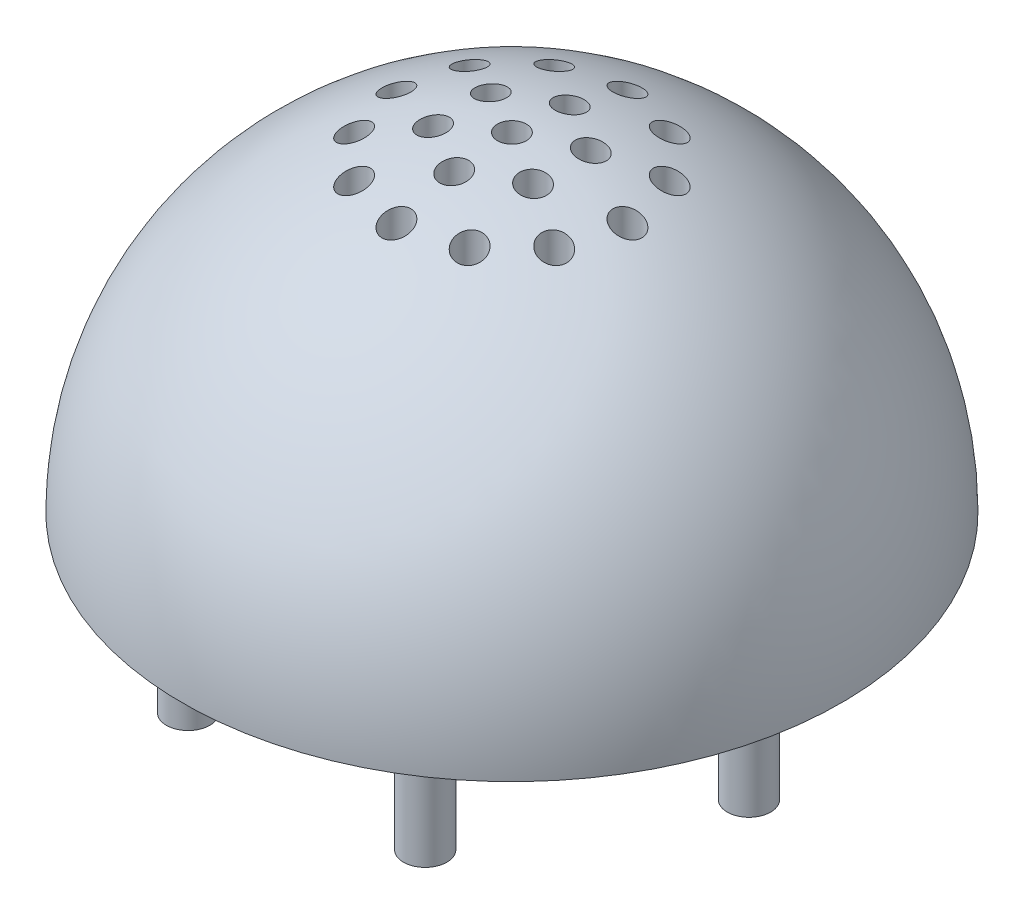
from build123d import *

# Parameters (mm, degrees)
SCHIZZO1_R                   = 9
ESTRUSIONE_ESTRUSIONE2_DEPTH = 7
SCHIZZO5_R                   = 5
TAGLIO_ESTRUSIONE1_DEPTH     = 9
SCHIZZO6_R                   = 0.5
TAGLIO_ESTRUSIONE2_DEPTH     = 9
SCHIZZO7_R                   = 0.75
ESTRUSIONE_ESTRUSIONE3_DEPTH = 4.5


with BuildPart() as part:
    # Schizzo1 → Estrusione-Estrusione2 (new body)
    with BuildSketch(Plane(origin=(0, 0, 0), x_dir=(1, 0, 0), z_dir=(0, 1, 0))):
        with Locations(Location((0, 0, 0), (0, 0, 270))):
            Circle(SCHIZZO1_R)
    extrude(amount=ESTRUSIONE_ESTRUSIONE2_DEPTH)

    # Schizzo4 → Rivoluzione3 (revolve)
    with BuildSketch(Plane.XY):
        with BuildLine():
            Line((11.401754251, 0), (0, 0))
            Line((0, 0), (0, 11.401754251))
            ThreePointArc((0, 11.401754251), (8.062257748, 8.062257748), (11.401754251, 0))
        make_face()
    revolve(axis=Axis((0, 0, 0), (0, 1, 0)))

    # Schizzo5 → Taglio-Estrusione1 (cut)
    with BuildSketch(Plane.XZ):
        with Locations(Location((0, 0, 0), (0, 0, 270))):
            Circle(SCHIZZO5_R)
    extrude(amount=-TAGLIO_ESTRUSIONE1_DEPTH, mode=Mode.SUBTRACT)

    # Schizzo6 → Taglio-Estrusione2 (cut)
    with BuildSketch(Plane.XZ.offset(-9)):
        with Locations(Location((0, -3.996181298, 0), (0, 0, 270.000000048))):
            Circle(SCHIZZO6_R)
        with Locations(Location((0, 0, 0), (0, 0, 270))):
            Circle(SCHIZZO6_R)
        with Locations(Location((0, -1.998090649, 0), (0, 0, 270.000000001))):
            Circle(SCHIZZO6_R)
        with Locations(Location((-1.730397261, -0.999045324, 0), (0, 0, 270))):
            Circle(SCHIZZO6_R)
        with Locations(Location((-1.730397261, 0.999045324, 0), (0, 0, 270))):
            Circle(SCHIZZO6_R)
        with Locations(Location((0, 1.998090649, 0), (0, 0, 270))):
            Circle(SCHIZZO6_R)
        with Locations(Location((1.730397261, 0.999045324, 0), (0, 0, 270))):
            Circle(SCHIZZO6_R)
        with Locations(Location((1.730397261, -0.999045324, 0), (0, 0, 270))):
            Circle(SCHIZZO6_R)
        with Locations(Location((-1.998090649, -3.460794522, 0), (0, 0, 270))):
            Circle(SCHIZZO6_R)
        with Locations(Location((-3.460794522, -1.998090649, 0), (0, 0, 270))):
            Circle(SCHIZZO6_R)
        with Locations(Location((-3.996181298, 0, 0), (0, 0, 270))):
            Circle(SCHIZZO6_R)
        with Locations(Location((-3.460794522, 1.998090649, 0), (0, 0, 270))):
            Circle(SCHIZZO6_R)
        with Locations(Location((-1.998090649, 3.460794522, 0), (0, 0, 270))):
            Circle(SCHIZZO6_R)
        with Locations(Location((0, 3.996181298, 0), (0, 0, 270))):
            Circle(SCHIZZO6_R)
        with Locations(Location((1.998090649, 3.460794522, 0), (0, 0, 270))):
            Circle(SCHIZZO6_R)
        with Locations(Location((3.460794522, 1.998090649, 0), (0, 0, 270))):
            Circle(SCHIZZO6_R)
        with Locations(Location((3.996181298, 0, 0), (0, 0, 270))):
            Circle(SCHIZZO6_R)
        with Locations(Location((3.460794522, -1.998090649, 0), (0, 0, 270))):
            Circle(SCHIZZO6_R)
        with Locations(Location((1.998090649, -3.460794522, 0), (0, 0, 270))):
            Circle(SCHIZZO6_R)
    extrude(amount=-TAGLIO_ESTRUSIONE2_DEPTH, mode=Mode.SUBTRACT)

    # Schizzo7 → Estrusione-Estrusione3 (add)
    with BuildSketch(Plane.XZ):
        with Locations(Location((8.200877125, 0, 0), (0, 0, 90))):
            Circle(SCHIZZO7_R)
        with Locations(Location((4.100438563, -7.102167924, 0), (0, 0, 90))):
            Circle(SCHIZZO7_R)
        with Locations(Location((-4.100438563, -7.102167924, 0), (0, 0, 90))):
            Circle(SCHIZZO7_R)
        with Locations(Location((-8.200877125, 0, 0), (0, 0, 90))):
            Circle(SCHIZZO7_R)
        with Locations(Location((-4.100438563, 7.102167924, 0), (0, 0, 90))):
            Circle(SCHIZZO7_R)
        with Locations(Location((4.100438563, 7.102167924, 0), (0, 0, 90))):
            Circle(SCHIZZO7_R)
    extrude(amount=ESTRUSIONE_ESTRUSIONE3_DEPTH)


solid = part.part
